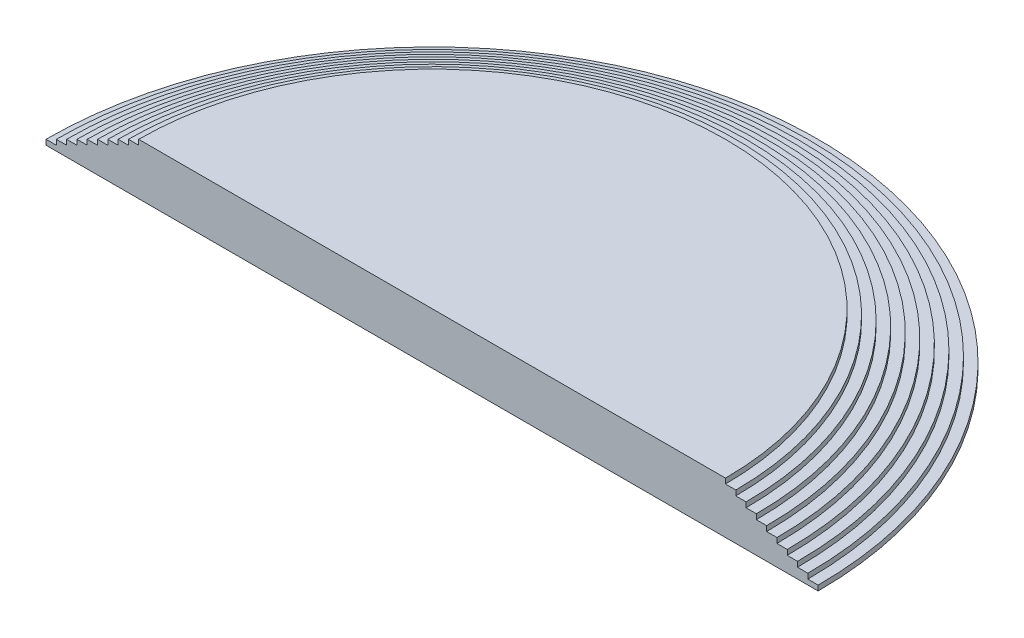
from build123d import *

# Parameters (mm, degrees)
EXTRUDE_1_DEPTH  = 0.2
EXTRUDE_3_DEPTH  = 0.2
EXTRUDE_4_DEPTH  = 0.2
EXTRUDE_5_DEPTH  = 0.2
EXTRUDE_6_DEPTH  = 0.2
EXTRUDE_7_DEPTH  = 0.2
EXTRUDE_8_DEPTH  = 0.2
EXTRUDE_9_DEPTH  = 0.2
EXTRUDE_10_DEPTH = 0.2
EXTRUDE_11_DEPTH = 0.2


with BuildPart() as part:
    # 草图1 → 凸台-拉伸1 (new body)
    with BuildSketch(Plane(origin=(0, 0, 0), x_dir=(1, 0, 0), z_dir=(0, 1, 0))):
        with BuildLine():
            Line((-15, 0), (15, 0))
            ThreePointArc((15, 0), (0, 15), (-15, 0))
        make_face()
    extrude(amount=EXTRUDE_1_DEPTH)

    # 草图2 → 凸台-拉伸3 (add)
    with BuildSketch(Plane(origin=(0, 0.2, 0), x_dir=(1, 0, 0), z_dir=(0, 1, 0))):
        with BuildLine():
            Line((-14.6, 0), (14.6, 0))
            ThreePointArc((14.6, 0), (0, 14.6), (-14.6, 0))
        make_face()
    extrude(amount=EXTRUDE_3_DEPTH)

    # 草图3 → 凸台-拉伸4 (add)
    with BuildSketch(Plane(origin=(0, 0.4, 0), x_dir=(1, 0, 0), z_dir=(0, 1, 0))):
        with BuildLine():
            Line((-14.2, 0), (14.2, 0))
            ThreePointArc((14.2, 0), (0, 14.2), (-14.2, 0))
        make_face()
    extrude(amount=EXTRUDE_4_DEPTH)

    # 草图4 → 凸台-拉伸5 (add)
    with BuildSketch(Plane(origin=(0, 0.6, 0), x_dir=(1, 0, 0), z_dir=(0, 1, 0))):
        with BuildLine():
            Line((-13.8, 0), (13.8, 0))
            ThreePointArc((13.8, 0), (0, 13.8), (-13.8, 0))
        make_face()
    extrude(amount=EXTRUDE_5_DEPTH)

    # 草图5 → 凸台-拉伸6 (add)
    with BuildSketch(Plane(origin=(0, 0.8, 0), x_dir=(1, 0, 0), z_dir=(0, 1, 0))):
        with BuildLine():
            Line((-13.4, 0), (13.4, 0))
            ThreePointArc((13.4, 0), (0, 13.4), (-13.4, 0))
        make_face()
    extrude(amount=EXTRUDE_6_DEPTH)

    # 草图6 → 凸台-拉伸7 (add)
    with BuildSketch(Plane(origin=(0, 1, 0), x_dir=(1, 0, 0), z_dir=(0, 1, 0))):
        with BuildLine():
            Line((-13, 0), (13, 0))
            ThreePointArc((13, 0), (0, 13), (-13, 0))
        make_face()
    extrude(amount=EXTRUDE_7_DEPTH)

    # 草图7 → 凸台-拉伸8 (add)
    with BuildSketch(Plane(origin=(0, 1.2, 0), x_dir=(1, 0, 0), z_dir=(0, 1, 0))):
        with BuildLine():
            Line((-12.6, 0), (12.6, 0))
            ThreePointArc((12.6, 0), (0, 12.6), (-12.6, 0))
        make_face()
    extrude(amount=EXTRUDE_8_DEPTH)

    # 草图8 → 凸台-拉伸9 (add)
    with BuildSketch(Plane(origin=(0, 1.4, 0), x_dir=(1, 0, 0), z_dir=(0, 1, 0))):
        with BuildLine():
            Line((-12.2, 0), (12.2, 0))
            ThreePointArc((12.2, 0), (0, 12.2), (-12.2, 0))
        make_face()
    extrude(amount=EXTRUDE_9_DEPTH)

    # 草图9 → 凸台-拉伸10 (add)
    with BuildSketch(Plane(origin=(0, 1.6, 0), x_dir=(1, 0, 0), z_dir=(0, 1, 0))):
        with BuildLine():
            Line((-11.8, 0), (11.8, 0))
            ThreePointArc((11.8, 0), (0, 11.8), (-11.8, 0))
        make_face()
    extrude(amount=EXTRUDE_10_DEPTH)

    # 草图10 → 凸台-拉伸11 (add)
    with BuildSketch(Plane(origin=(0, 1.8, 0), x_dir=(1, 0, 0), z_dir=(0, 1, 0))):
        with BuildLine():
            Line((-11.4, 0), (11.4, 0))
            ThreePointArc((11.4, 0), (0, 11.4), (-11.4, 0))
        make_face()
    extrude(amount=EXTRUDE_11_DEPTH)


solid = part.part
